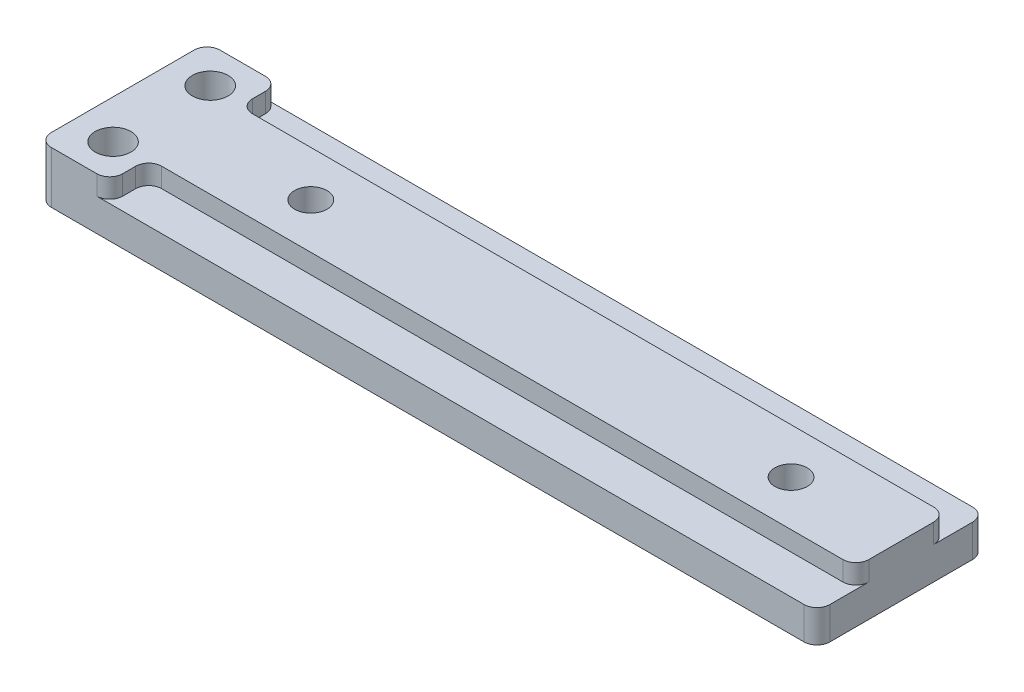
from build123d import *

# Parameters (mm, degrees)
SKETCH1_W           = 152.4
SKETCH1_H           = 33.02
SKETCH1_R           = 3.5
SKETCH1_R_2         = 3.175
BOSS_EXTRUDE1_DEPTH = 10.16
SKETCH3_W           = 7.62
SKETCH3_H           = 3.81
CUT_EXTRUDE1_DEPTH  = 138.43
FILLET1_R           = 2.54


with BuildPart() as part:
    # Sketch1 → Boss-Extrude1 (new body)
    with BuildSketch(Plane(origin=(0, 0, 0), x_dir=(1, 0, 0), z_dir=(0, 1, 0))):
        with Locations((76.2, 16.51)):
            Rectangle(SKETCH1_W, SKETCH1_H)
        with Locations(Location((7.62, 26.02, 0), (0, 0, 270))):
            Circle(SKETCH1_R, mode=Mode.SUBTRACT)
        with Locations(Location((7.62, 7, 0), (0, 0, 90))):
            Circle(SKETCH1_R, mode=Mode.SUBTRACT)
        with Locations(Location((130.8199949, 16.51, 0), (0, 0, 270))):
            Circle(SKETCH1_R_2, mode=Mode.SUBTRACT)
        with Locations(Location((36.8200051, 16.51, 0), (0, 0, 270))):
            Circle(SKETCH1_R_2, mode=Mode.SUBTRACT)
    extrude(amount=BOSS_EXTRUDE1_DEPTH)

    # Sketch3 → Cut-Extrude1 (cut)
    with BuildSketch(Plane(origin=(152.4, 0, 0), x_dir=(0, 0, -1), z_dir=(1, 0, 0))):
        with Locations((3.81, 8.255)):
            Rectangle(SKETCH3_W, SKETCH3_H)
        with Locations((29.21, 8.255)):
            Rectangle(SKETCH3_W, SKETCH3_H)
    extrude(amount=-CUT_EXTRUDE1_DEPTH, mode=Mode.SUBTRACT)

    # Fillet1
    fillet1_edges = [part.edges().sort_by_distance(p)[0] for p in [
        (152.4, 3.175, -33.02),
        (152.4, 3.175, 0),
        (13.97, 8.255, 0),
        (13.97, 8.255, -7.62),
        (152.4, 8.255, -7.62),
        (13.97, 8.255, -33.02),
        (13.97, 8.255, -25.4),
        (152.4, 8.255, -25.4),
        (0, 5.08, 0),
        (0, 5.08, -33.02),
    ]]
    fillet(fillet1_edges, radius=FILLET1_R)


solid = part.part
